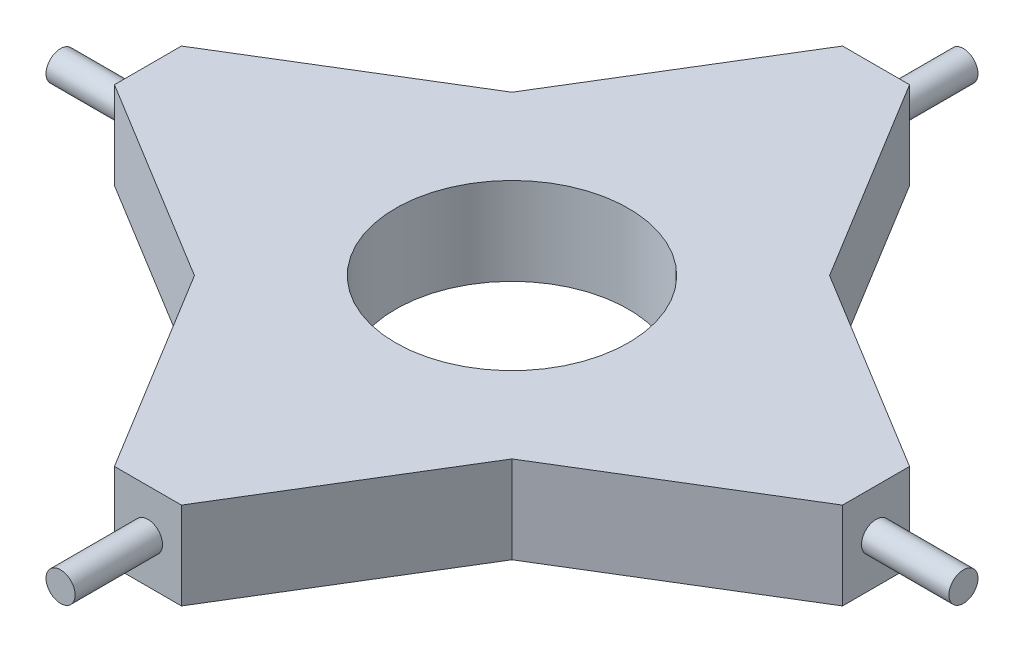
from build123d import *

# Parameters (mm, degrees)
SKETCH1_R           = 40
BOSS_EXTRUDE1_DEPTH = 30
SKETCH2_R           = 5
BOSS_EXTRUDE2_DEPTH = 30
CIRPATTERN1_COUNT   = 4


with BuildPart() as part:
    # Sketch1 → Boss-Extrude1 (new body)
    with BuildSketch(Plane(origin=(0, 0, 0), x_dir=(1, 0, 0), z_dir=(0, 1, 0))):
        Polygon((11.5, 125), (-11.5, 125), (-54.518512439, 54.518512439), (-125, 11.5), (-125, -11.5), (-54.518512439, -54.518512439), (-11.5, -125), (11.5, -125), (54.518512439, -54.518512439), (125, -11.5), (125, 11.5), (54.518512439, 54.518512439), align=None)
        with Locations(Location((0, 0, 0), (0, 0, 270))):
            Circle(SKETCH1_R, mode=Mode.SUBTRACT)
    extrude(amount=BOSS_EXTRUDE1_DEPTH)

    # Sketch2 → Boss-Extrude2 (add)
    with BuildSketch(Plane.XY.offset(125)):
        with Locations((0, 15)):
            Circle(SKETCH2_R)
    boss_extrude2 = extrude(amount=BOSS_EXTRUDE2_DEPTH)

    # CirPattern1: Boss-Extrude2 ×4 about axis
    cirpattern1_axis = Axis((0, 0, 0), (0, 1, 0))
    for i in range(1, CIRPATTERN1_COUNT):
        add(boss_extrude2.rotate(cirpattern1_axis, i * 360 / CIRPATTERN1_COUNT))


solid = part.part
